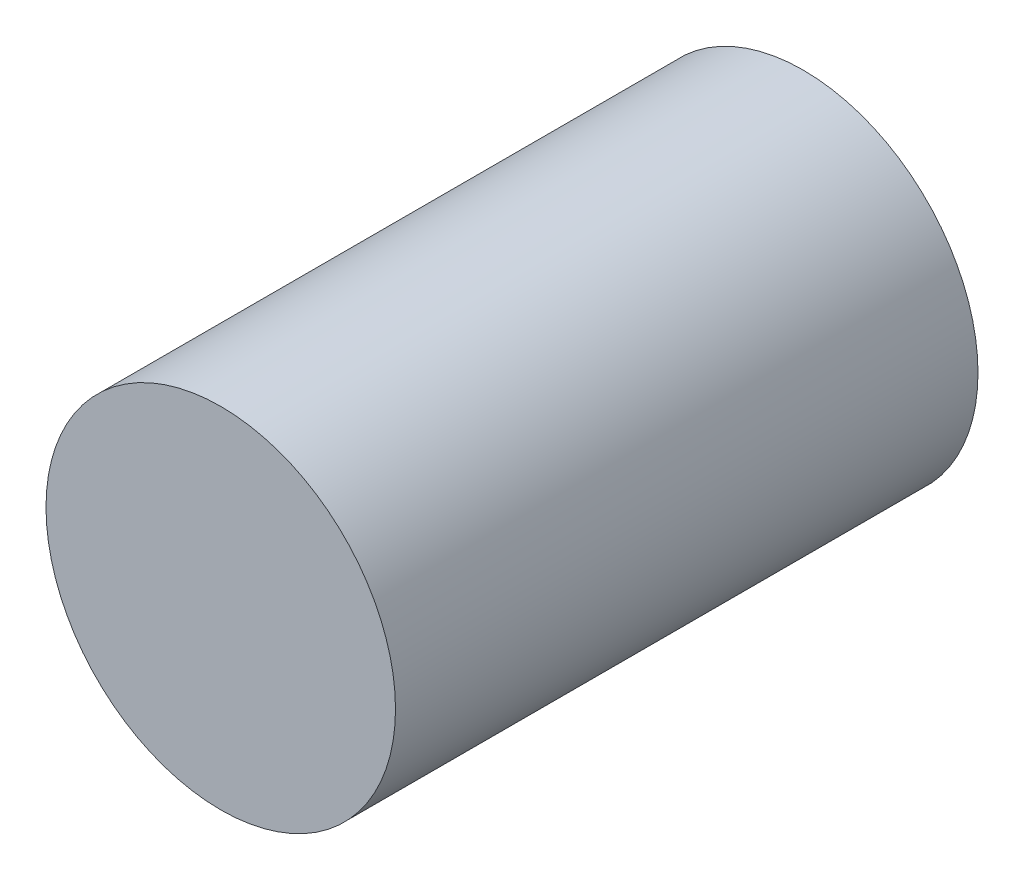
from build123d import *

# Parameters (mm, degrees)
SKETCH1_R           = 30
BOSS_EXTRUDE1_DEPTH = 100


with BuildPart() as part:
    # Sketch1 → Boss-Extrude1 (new body)
    with BuildSketch(Plane.XY):
        Circle(SKETCH1_R)
    extrude(amount=BOSS_EXTRUDE1_DEPTH)

    # Sketch2 → Revolve1 (revolve)
    with BuildSketch(Plane(origin=(0, 0, 0), x_dir=(1, 0, 0), z_dir=(0, 1, 0)), mode=Mode.PRIVATE) as revolve1_sk:
        with BuildLine():
            Line((0, 0), (30, 0))
            ThreePointArc((30, 0), (15.076344301, 2.271038384), (0, 3.030615433))
            Line((0, 3.030615433), (0, 0))
        make_face()
    revolve(revolve1_sk.sketch.rotate(Axis((0, 0, -3.030615433), (0, 0, 1)), 180), axis=Axis((0, 0, -3.030615433), (0, 0, 1)))


solid = part.part
